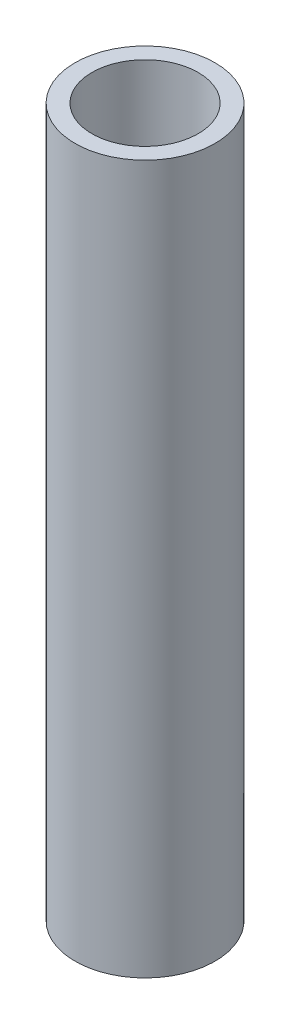
from build123d import *

# Parameters (mm, degrees)
SKETCH1_R           = 4.15
SKETCH1_R_2         = 3.15
BOSS_EXTRUDE1_DEPTH = 42


with BuildPart() as part:
    # Sketch1 → Boss-Extrude1 (new body)
    with BuildSketch(Plane(origin=(0, 0, 0), x_dir=(1, 0, 0), z_dir=(0, 1, 0))):
        with Locations(Location((0, 0, 0), (0, 0, 90))):
            Circle(SKETCH1_R)
        with Locations(Location((0, 0, 0), (0, 0, 90))):
            Circle(SKETCH1_R_2, mode=Mode.SUBTRACT)
    extrude(amount=BOSS_EXTRUDE1_DEPTH)


solid = part.part
